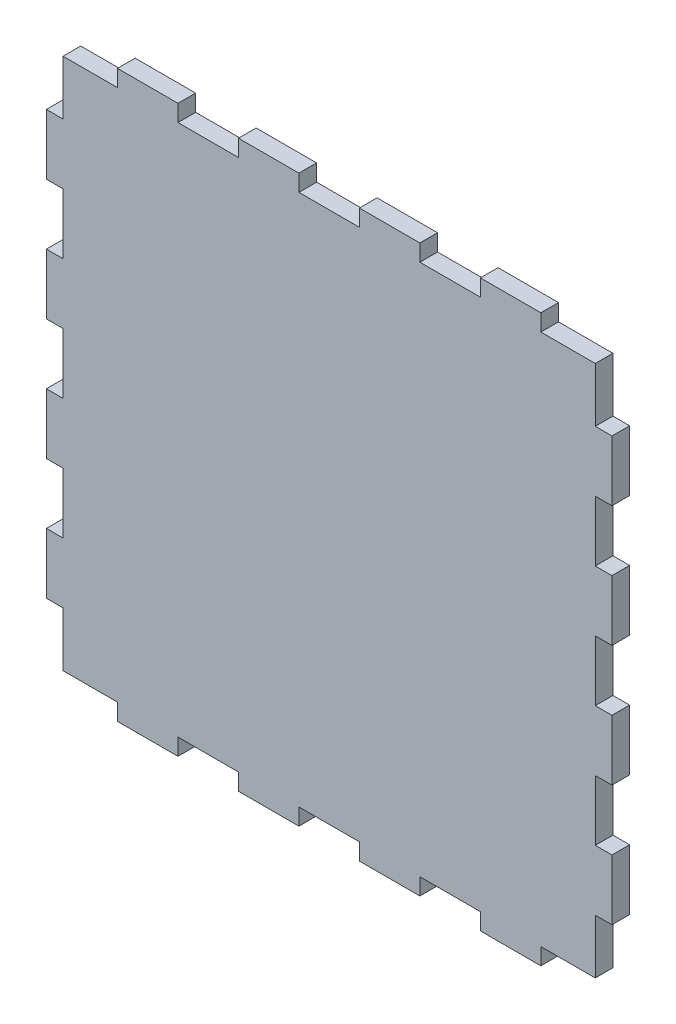
from build123d import *

# Parameters (mm, degrees)
BOSS_EXTRUDE1_DEPTH = 6.35


with BuildPart() as part:
    # Sketch3 → Boss-Extrude1 (new body)
    with BuildSketch(Plane.XY):
        Polygon((0, 177.65395), (0, 155.92425), (5.9944, 155.92425), (5.9944, 134.19455), (0, 134.19455), (0, 112.46485), (5.9944, 112.46485), (5.9944, 90.73515), (0, 90.73515), (0, 69.00545), (5.9944, 69.00545), (5.9944, 47.27575), (0, 47.27575), (0, 25.54605), (5.9944, 25.54605), (5.9944, 5.9944), (25.54605, 5.9944), (25.54605, 0), (47.27575, 0), (47.27575, 5.9944), (69.00545, 5.9944), (69.00545, 0), (90.73515, 0), (90.73515, 5.9944), (112.46485, 5.9944), (112.46485, 0), (134.19455, 0), (134.19455, 5.9944), (155.92425, 5.9944), (155.92425, 0), (177.65395, 0), (177.65395, 5.9944), (197.2056, 5.9944), (197.2056, 25.54605), (203.2, 25.54605), (203.2, 47.27575), (197.2056, 47.27575), (197.2056, 69.00545), (203.2, 69.00545), (203.2, 90.73515), (197.2056, 90.73515), (197.2056, 112.46485), (203.2, 112.46485), (203.2, 134.19455), (197.2056, 134.19455), (197.2056, 155.92425), (203.2, 155.92425), (203.2, 177.65395), (197.2056, 177.65395), (197.2056, 197.2056), (177.65395, 197.2056), (177.65395, 203.2), (155.92425, 203.2), (155.92425, 197.2056), (134.19455, 197.2056), (134.19455, 203.2), (112.46485, 203.2), (112.46485, 197.2056), (90.73515, 197.2056), (90.73515, 203.2), (69.00545, 203.2), (69.00545, 197.2056), (47.27575, 197.2056), (47.27575, 203.2), (25.54605, 203.2), (25.54605, 197.2056), (5.9944, 197.2056), (5.9944, 177.65395), align=None)
    extrude(amount=BOSS_EXTRUDE1_DEPTH)


solid = part.part
